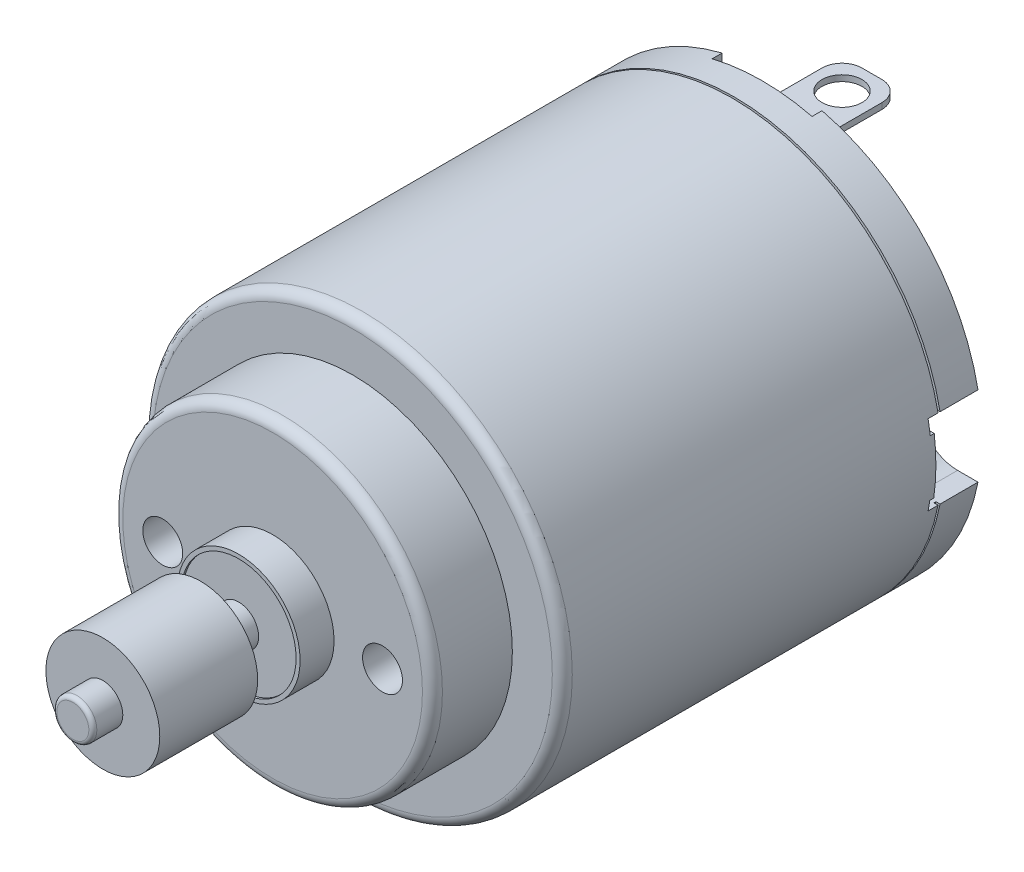
from build123d import *
from build123d.topology import SkipClean

# Parameters (mm, degrees)
ESBO_O1_R                  = 1
RESSALTO_EXTRUS_O1_DEPTH   = 38
ESBO_O2_R                  = 8
RESSALTO_EXTRUS_O2_DEPTH   = 25
ESBO_O3_R                  = 3.075
RESSALTO_EXTRUS_O3_DEPTH   = 1.7
ESBO_O4_R                  = 10.5
RESSALTO_EXTRUS_O4_DEPTH   = 21
ESBO_O5_R                  = 3.125
RESSALTO_EXTRUS_O5_DEPTH   = 2
ESBO_O6_W                  = 3
ESBO_O6_H                  = 0.3
RESSALTO_EXTRUS_O6_DEPTH   = 5
ESBO_O7_R                  = 1
CORTE_EXTRUS_O1_DEPTH      = 4
ESBO_O8_R                  = 1
CORTE_EXTRUS_O2_DEPTH      = 4
FILETE1_R                  = 1
FILETE2_R                  = 0.2
CORTE_EXTRUS_O3_DEPTH      = 15
CORTE_EXTRUS_O3_DEPTH_BACK = 38
ESBO_O9_R                  = 1
ESBO_O10_W                 = 1.239132447
ESBO_O10_H                 = 9.327126009
CORTE_EXTRUS_O4_DEPTH      = 2
CORTE_EXTRUS_O5_DEPTH      = 0.5
CORTE_EXTRUS_O6_DEPTH      = 2
ESBO_O13_W                 = 3
ESBO_O13_H                 = 0.3
RESSALTO_EXTRUS_O7_DEPTH   = 6
ESBO_O14_R                 = 11.30933102
ESBO_O14_R_2               = 10.3
CORTE_EXTRUS_O7_DEPTH      = 0.1
FILETE3_R                  = 0.5
ESBO_O15_R                 = 2.875
CORTE_EXTRUS_O8_DEPTH      = 0.1
CORTE_EXTRUS_O9_DEPTH      = 2.5
RESSALTO_EXTRUS_O8_DEPTH   = 0.2
ESBO_O18_R                 = 2.85
RESSALTO_EXTRUS_O9_DEPTH   = 4.9


with BuildPart() as part:
    # Esboço1 → Ressalto-extrusão1 (new body)
    with BuildSketch(Plane.XY):
        Circle(ESBO_O1_R)
    extrude(amount=RESSALTO_EXTRUS_O1_DEPTH)

    # Esboço2 → Ressalto-extrusão2 (add)
    with BuildSketch(Plane.XY.offset(28)):
        Circle(ESBO_O2_R)
    extrude(amount=-RESSALTO_EXTRUS_O2_DEPTH)

    # Esboço3 → Ressalto-extrusão3 (add)
    with BuildSketch(Plane.XY.offset(28)):
        Circle(ESBO_O3_R)
    extrude(amount=RESSALTO_EXTRUS_O3_DEPTH)

    # Esboço4 → Ressalto-extrusão4 (add)
    with BuildSketch(Plane(origin=(0, 0, 3), x_dir=(-1, 0, 0), z_dir=(0, 0, -1))):
        Circle(ESBO_O4_R)
    extrude(amount=-RESSALTO_EXTRUS_O4_DEPTH)

    # Esboço5 → Ressalto-extrusão5 (add)
    with BuildSketch(Plane(origin=(0, 0, 3), x_dir=(-1, 0, 0), z_dir=(0, 0, -1))):
        with Locations(Location((0, 0, 0), (0, 0, 180))):
            Circle(ESBO_O5_R)
    extrude(amount=RESSALTO_EXTRUS_O5_DEPTH)

    # Esboço6 → Ressalto-extrusão6 (add)
    with BuildSketch(Plane(origin=(0, 0, 3), x_dir=(-1, 0, 0), z_dir=(0, 0, -1))):
        with Locations((0, 7.9)):
            Rectangle(ESBO_O6_W, ESBO_O6_H)
        with Locations((0, -7.9)):
            Rectangle(ESBO_O6_W, ESBO_O6_H)
    extrude(amount=RESSALTO_EXTRUS_O6_DEPTH)

    # Esboço7 → Corte-extrusão1 (cut)
    with BuildSketch(Plane(origin=(0, 8.05, 0), x_dir=(1, 0, 0), z_dir=(0, 1, 0))):
        with Locations(Location((0, 0.5, 0), (0, 0, 270))):
            Circle(ESBO_O7_R)
    extrude(amount=-CORTE_EXTRUS_O1_DEPTH, mode=Mode.SUBTRACT)

    # Esboço8 → Corte-extrusão2 (cut)
    with BuildSketch(Plane(origin=(0, -7.75, 0), x_dir=(1, 0, 0), z_dir=(0, 1, 0))):
        with Locations(Location((0, 0.5, 0), (0, 0, 270))):
            Circle(ESBO_O8_R)
    extrude(amount=-CORTE_EXTRUS_O2_DEPTH, mode=Mode.SUBTRACT)

    # Filete1
    filete1_edges = [part.edges().sort_by_distance(p)[0] for p in [
        (1.5, 7.9, -2),
        (-1.5, 7.9, -2),
        (1.5, -7.9, -2),
        (-1.5, -7.9, -2),
    ]]
    fillet(filete1_edges, radius=FILETE1_R)

    # Filete2
    filete2_edges = [part.edges().sort_by_distance(p)[0] for p in [
        (-1, 0, 0),
        (-1, 0, 38),
    ]]
    fillet(filete2_edges, radius=FILETE2_R)

    # Esboço9 → Corte-extrusão3 (cut, two sides: drawn at the far end of the back side and taken through both)
    with BuildSketch(Plane(origin=(0, 0, 3), x_dir=(-1, 0, 0), z_dir=(0, 0, -1)).offset(-CORTE_EXTRUS_O3_DEPTH_BACK)):
        with Locations(Location((-5.5, 0, 0), (0, 0, 180))):
            Circle(ESBO_O9_R)
        with Locations(Location((5.5, 0, 0), (0, 0, 180))):
            Circle(ESBO_O9_R)
    extrude(amount=CORTE_EXTRUS_O3_DEPTH + CORTE_EXTRUS_O3_DEPTH_BACK, mode=Mode.SUBTRACT)

    # Esboço10 → Corte-extrusão4 (cut)
    with BuildSketch(Plane(origin=(0, 0, 1), x_dir=(-1, 0, 0), z_dir=(0, 0, -1))):
        with Locations((3.194566224, -0.245450684)):
            Rectangle(ESBO_O10_W, ESBO_O10_H)
    extrude(amount=-CORTE_EXTRUS_O4_DEPTH, mode=Mode.SUBTRACT)

    # Esboço11 → Corte-extrusão5 (cut)
    with BuildSketch(Plane(origin=(0, 0, 3), x_dir=(-1, 0, 0), z_dir=(0, 0, -1))):
        with BuildLine():
            Line((-3.708099244, 1.5), (-7.348469228, 1.5))
            ThreePointArc((-7.348469228, 1.5), (-5.657498182, 4.923689097), (-2.5, 7.071067812))
            Line((-2.5, 7.071067812), (-2.5, 12.5))
            Line((-2.5, 12.5), (2.5, 12.5))
            Line((2.5, 12.5), (2.5, 7.071067812))
            ThreePointArc((2.5, 7.071067812), (5.657498182, 4.923689097), (7.348469228, 1.5))
            Line((7.348469228, 1.5), (3.708099244, 1.5))
            ThreePointArc((3.708099244, 1.5), (3.208309493, 2.388880532), (2.5, 3.122498999))
            ThreePointArc((2.5, 3.122498999), (-1.011435463, 3.870012701), (-3.708099244, 1.5))
        make_face()
        with BuildLine():
            Line((7.348469228, -1.5), (3.708099244, -1.5))
            ThreePointArc((3.708099244, -1.5), (1.011435463, -3.870012701), (-2.5, -3.122498999))
            ThreePointArc((-2.5, -3.122498999), (-3.208309493, -2.388880532), (-3.708099244, -1.5))
            Line((-3.708099244, -1.5), (-7.348469228, -1.5))
            ThreePointArc((-7.348469228, -1.5), (-5.657498182, -4.923689097), (-2.5, -7.071067812))
            Line((-2.5, -7.071067812), (-2.5, -12.5))
            Line((-2.5, -12.5), (2.5, -12.5))
            Line((2.5, -12.5), (2.5, -7.071067812))
            ThreePointArc((2.5, -7.071067812), (5.657498182, -4.923689097), (7.348469228, -1.5))
        make_face()
    extrude(amount=-CORTE_EXTRUS_O5_DEPTH, mode=Mode.SUBTRACT)


with BuildPart() as corte_extrus_o5_piece_1:
    # of the separate pieces the step leaves, piece 1, a body of its own (corte_extrus_o5_pieces)
    add(part.part.solids().sort_by_distance((1, 0, 0.2))[0])

    # Esboço12 → Corte-extrusão6 (cut)
    with BuildSketch(Plane(origin=(0, 0, 3.5), x_dir=(-1, 0, 0), z_dir=(0, 0, -1))):
        with BuildLine():
            ThreePointArc((3.375, -5.845671476), (4.772970773, -4.772970773), (5.845671476, -3.375))
            ThreePointArc((5.845671476, -3.375), (5.479646072, -2.008974596), (4.113620668, -2.375))
            ThreePointArc((4.113620668, -2.375), (3.358757211, -3.358757211), (2.375, -4.113620668))
            ThreePointArc((2.375, -4.113620668), (2.008974596, -5.479646072), (3.375, -5.845671476))
        make_face()
        with BuildLine():
            ThreePointArc((-3.375, 5.845671476), (-4.772970773, 4.772970773), (-5.845671476, 3.375))
            ThreePointArc((-5.845671476, 3.375), (-5.479646072, 2.008974596), (-4.113620668, 2.375))
            ThreePointArc((-4.113620668, 2.375), (-3.358757211, 3.358757211), (-2.375, 4.113620668))
            ThreePointArc((-2.375, 4.113620668), (-2.008974596, 5.479646072), (-3.375, 5.845671476))
        make_face()
    extrude(amount=-CORTE_EXTRUS_O6_DEPTH, mode=Mode.SUBTRACT)



with BuildPart() as corte_extrus_o5_piece_2:
    # of the separate pieces the step leaves, piece 2, a body of its own (corte_extrus_o5_pieces)
    add(part.part.solids().sort_by_distance((-1.5, 7.75, -1))[0])


with BuildPart() as corte_extrus_o5_piece_3:
    # of the separate pieces the step leaves, piece 3, a body of its own (corte_extrus_o5_pieces)
    add(part.part.solids().sort_by_distance((-1.5, -8.05, -1))[0])


with BuildPart() as corte_extrus_o5_piece_1_1:
    add(corte_extrus_o5_piece_1.part)

    add(corte_extrus_o5_piece_2.part)  # Ressalto-extrusão7 merges Corte-extrusão5 piece 2

    add(corte_extrus_o5_piece_3.part)  # Ressalto-extrusão7 merges Corte-extrusão5 piece 3
    # Esboço13 → Ressalto-extrusão7 (add)
    with BuildSketch(Plane.XY.offset(3)):
        with Locations((0, 7.9)):
            Rectangle(ESBO_O13_W, ESBO_O13_H)
        with Locations((0, -7.9)):
            Rectangle(ESBO_O13_W, ESBO_O13_H)
    extrude(amount=RESSALTO_EXTRUS_O7_DEPTH)

    # Esboço14 → Corte-extrusão7 (cut)
    with BuildSketch(Plane(origin=(0, 0, 5), x_dir=(-1, 0, 0), z_dir=(0, 0, -1))):
        Circle(ESBO_O14_R)
        Circle(ESBO_O14_R_2, mode=Mode.SUBTRACT)
    extrude(amount=CORTE_EXTRUS_O7_DEPTH, mode=Mode.SUBTRACT)

    # Filete3
    filete3_edges = [corte_extrus_o5_piece_1_1.edges().sort_by_distance(p)[0] for p in [
        (-8, 0, 28),
        (10.5, 0, 24),
    ]]
    fillet(filete3_edges, radius=FILETE3_R)

    # Esboço15 → Corte-extrusão8 (cut)
    with BuildSketch(Plane.XY.offset(29.7)):
        Circle(ESBO_O15_R)
    extrude(amount=-CORTE_EXTRUS_O8_DEPTH, mode=Mode.SUBTRACT)


with BuildPart() as corte_extrus_o8_piece_1:
    # of the separate pieces the step leaves, piece 1, a body of its own (corte_extrus_o8_pieces)
    add(corte_extrus_o5_piece_1_1.part.solids().sort_by_distance((7.5, 0, 28))[0])

    # Esboço16 → Corte-extrusão9 (cut)
    with BuildSketch(Plane(origin=(0, 0, 3), x_dir=(-1, 0, 0), z_dir=(0, 0, -1))):
        with BuildLine():
            Line((-9.287087811, 2), (-10.307764064, 2))
            ThreePointArc((-10.307764064, 2), (-10.5, 0), (-10.307764064, -2))
            Line((-10.307764064, -2), (-9.287087811, -2))
            ThreePointArc((-9.287087811, -2), (-7.287087811, 0), (-9.287087811, 2))
        make_face()
        with BuildLine():
            Line((10.307764064, 2), (9.287087811, 2))
            ThreePointArc((9.287087811, 2), (7.287087811, 0), (9.287087811, -2))
            Line((9.287087811, -2), (10.307764064, -2))
            ThreePointArc((10.307764064, -2), (10.5, 0), (10.307764064, 2))
        make_face()
    extrude(amount=-CORTE_EXTRUS_O9_DEPTH, mode=Mode.SUBTRACT)

    # Esboço17 → Ressalto-extrusão8 (add)
    with SkipClean():  # the faces are left unmerged after this step: merging them gives an invalid solid
        with BuildSketch(Plane(origin=(0, 0, 5.5), x_dir=(-1, 0, 0), z_dir=(0, 0, -1))):
            with BuildLine():
                ThreePointArc((10.417048469, -1.317232401), (10.5, 0), (10.417048469, 1.317232401))
                Line((10.417048469, 1.317232401), (8.597314976, 1.317232401))
                Line((8.597314976, 1.317232401), (8.395134617, 1.117244286))
                Line((8.395134617, 1.117244286), (8.368780624, -1.300011885))
                Line((8.368780624, -1.300011885), (8.566600265, -1.5))
                Line((8.566600265, -1.5), (10.392304845, -1.5))
                ThreePointArc((10.392304845, -1.5), (10.405077959, -1.40867053), (10.417048469, -1.317232401))
            make_face()
            with BuildLine():
                Line((-8.395134617, 1.117244286), (-8.597314976, 1.317232401))
                Line((-8.597314976, 1.317232401), (-10.417048469, 1.317232401))
                ThreePointArc((-10.417048469, 1.317232401), (-10.499595037, -0.092217463), (-10.392304845, -1.5))
                Line((-10.392304845, -1.5), (-8.566600265, -1.5))
                Line((-8.566600265, -1.5), (-8.368780624, -1.300011885))
                Line((-8.368780624, -1.300011885), (-8.395134617, 1.117244286))
            make_face()
        extrude(amount=RESSALTO_EXTRUS_O8_DEPTH)


with BuildPart() as corte_extrus_o8_piece_2:
    # of the separate pieces the step leaves, piece 2, a body of its own (corte_extrus_o8_pieces)
    add(corte_extrus_o5_piece_1_1.part.solids().sort_by_distance((1, 0, 37.8))[0])

    # Esboço18 → Ressalto-extrusão9 (add)
    with BuildSketch(Plane.XY.offset(36.5)):
        Circle(ESBO_O18_R)
    extrude(amount=-RESSALTO_EXTRUS_O9_DEPTH)


solid = Compound([corte_extrus_o8_piece_1.part, corte_extrus_o8_piece_2.part])
